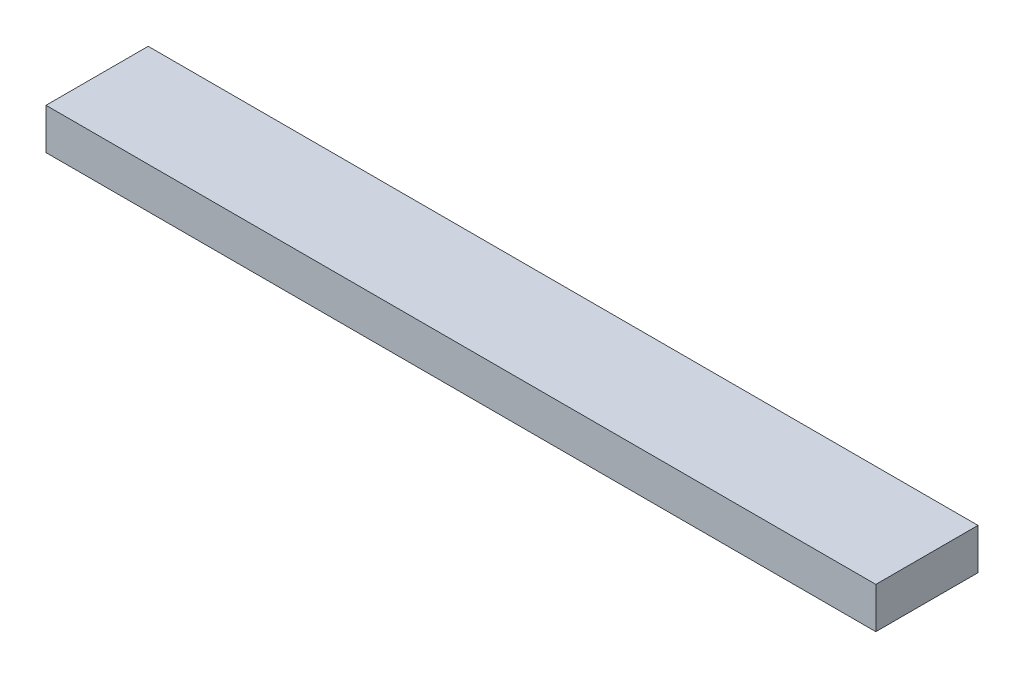
from build123d import *

# Parameters (mm, degrees)
SKETCH1_W           = 63.75
SKETCH1_H           = 7.85
BOSS_EXTRUDE1_DEPTH = 3.15
SHELL1_T            = -1.5
SKETCH2_R           = 1.5
SKETCH2_R_2         = 0.7
BOSS_EXTRUDE2_DEPTH = 1.45


with BuildPart() as part:
    # Sketch1 → Boss-Extrude1 (new body)
    with BuildSketch(Plane(origin=(0, 0, 0), x_dir=(1, 0, 0), z_dir=(0, 1, 0))):
        Rectangle(SKETCH1_W, SKETCH1_H)
    extrude(amount=-BOSS_EXTRUDE1_DEPTH)

    # Shell1
    shell1_openings = [part.faces().sort_by_distance(p)[0] for p in [
        (0, -3.15, 0),
    ]]
    offset(amount=SHELL1_T, openings=shell1_openings, kind=Kind.INTERSECTION)

    # Sketch2 → Boss-Extrude2 (add)
    # profile 1 of 7: a face of its own
    with BuildSketch(Plane.XZ.offset(1.5)):
        with Locations(Location((-23.90625, 0, 0), (0, 0, 90))):
            Circle(SKETCH2_R)
        with Locations(Location((-23.90625, 0, 0), (0, 0, 90))):
            Circle(SKETCH2_R_2, mode=Mode.SUBTRACT)
    # profile 2 of 7: a face of its own
    with BuildSketch(Plane.XZ.offset(1.5)):
        with Locations(Location((-15.93625, 0, 0), (0, 0, 90))):
            Circle(SKETCH2_R)
        with Locations(Location((-15.93625, 0, 0), (0, 0, 90))):
            Circle(SKETCH2_R_2, mode=Mode.SUBTRACT)
    # profile 3 of 7: a face of its own
    with BuildSketch(Plane.XZ.offset(1.5)):
        with Locations(Location((-7.96625, 0, 0), (0, 0, 90))):
            Circle(SKETCH2_R)
        with Locations(Location((-7.96625, 0, 0), (0, 0, 90))):
            Circle(SKETCH2_R_2, mode=Mode.SUBTRACT)
    # profile 4 of 7: a face of its own
    with BuildSketch(Plane.XZ.offset(1.5)):
        with Locations(Location((0.00375, 0, 0), (0, 0, 90))):
            Circle(SKETCH2_R)
        with Locations(Location((0.00375, 0, 0), (0, 0, 90))):
            Circle(SKETCH2_R_2, mode=Mode.SUBTRACT)
    # profile 5 of 7: a face of its own
    with BuildSketch(Plane.XZ.offset(1.5)):
        with Locations(Location((7.97375, 0, 0), (0, 0, 90))):
            Circle(SKETCH2_R)
        with Locations(Location((7.97375, 0, 0), (0, 0, 90))):
            Circle(SKETCH2_R_2, mode=Mode.SUBTRACT)
    # profile 6 of 7: a face of its own
    with BuildSketch(Plane.XZ.offset(1.5)):
        with Locations(Location((15.94375, 0, 0), (0, 0, 90))):
            Circle(SKETCH2_R)
        with Locations(Location((15.94375, 0, 0), (0, 0, 90))):
            Circle(SKETCH2_R_2, mode=Mode.SUBTRACT)
    # profile 7 of 7: a face of its own
    with BuildSketch(Plane.XZ.offset(1.5)):
        with Locations(Location((23.91375, 0, 0), (0, 0, 90))):
            Circle(SKETCH2_R)
        with Locations(Location((23.91375, 0, 0), (0, 0, 90))):
            Circle(SKETCH2_R_2, mode=Mode.SUBTRACT)
    extrude(amount=BOSS_EXTRUDE2_DEPTH)


solid = part.part
